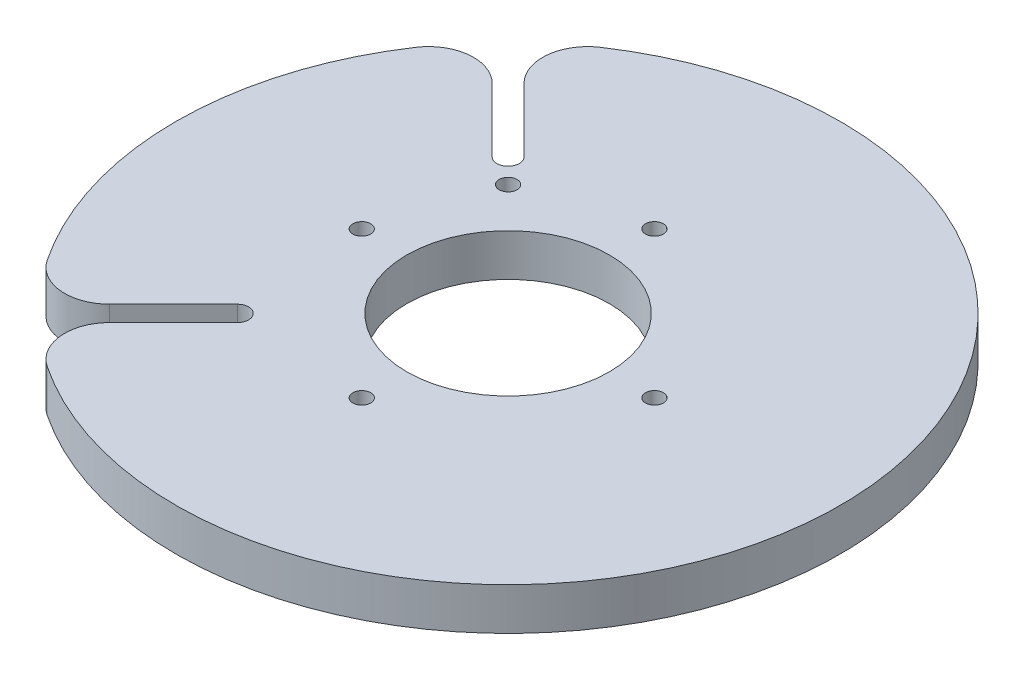
from build123d import *

# Parameters (mm, degrees)
SKETCH1_R           = 75
BOSS_EXTRUDE1_DEPTH = 9.525
CUT_EXTRUDE2_REACH  = 108.493
FILLET1_R           = 10.16
SKETCH39_R          = 22.86
SKETCH39_R_2        = 2.0193
CUT_EXTRUDE30_DEPTH = 247.31360274
SKETCH42_R          = 2.0193
CUT_EXTRUDE33_DEPTH = 247.31360274


with BuildPart() as part:
    # Sketch1 → Boss-Extrude1 (new body)
    with BuildSketch(Plane(origin=(0, 0, 0), x_dir=(1, 0, 0), z_dir=(0, 1, 0))):
        with Locations(Location((0, 0, 0), (0, 0, 90))):
            Circle(SKETCH1_R)
    extrude(amount=BOSS_EXTRUDE1_DEPTH)

    # Sketch11 → Cut-Extrude2 (cut, up to next)
    with BuildSketch(Plane(origin=(0, 9.525, 0), x_dir=(1, 0, 0), z_dir=(0, 1, 0)), mode=Mode.PRIVATE) as cut_extrude2_sk1:
        with BuildLine():
            Line((-54.798637954, 51.206535505), (-32.347997651, 28.755895202))
            ThreePointArc((-32.347997651, 28.755895202), (-28.755895202, 28.755895202), (-28.755895202, 32.347997651))
            Line((-28.755895202, 32.347997651), (-51.206535505, 54.798637954))
            ThreePointArc((-51.206535505, 54.798637954), (-53.033008589, 53.033008589), (-54.798637954, 51.206535505))
        make_face()
    cut_extrude2_tool1 = extrude(cut_extrude2_sk1.sketch, amount=-CUT_EXTRUDE2_REACH, mode=Mode.PRIVATE) & part.part
    # Sketch11 → Cut-Extrude2 (cut, up to next)
    with BuildSketch(Plane(origin=(0, 9.525, 0), x_dir=(1, 0, 0), z_dir=(0, 1, 0)), mode=Mode.PRIVATE) as cut_extrude2_sk2:
        with BuildLine():
            Line((-51.206535505, -54.798637954), (-28.755895202, -32.347997651))
            ThreePointArc((-28.755895202, -32.347997651), (-28.755895202, -28.755895202), (-32.347997651, -28.755895202))
            Line((-32.347997651, -28.755895202), (-54.798637954, -51.206535505))
            ThreePointArc((-54.798637954, -51.206535505), (-53.033008589, -53.033008589), (-51.206535505, -54.798637954))
        make_face()
    cut_extrude2_tool2 = extrude(cut_extrude2_sk2.sketch, amount=-CUT_EXTRUDE2_REACH, mode=Mode.PRIVATE) & part.part
    add(cut_extrude2_tool1.solids().sort_by_distance((-41.078737, 9.525, -41.078737))[0], mode=Mode.SUBTRACT)
    add(cut_extrude2_tool2.solids().sort_by_distance((-41.078737, 9.525, 41.078737))[0], mode=Mode.SUBTRACT)

    # Fillet1
    fillet1_edges = [part.edges().sort_by_distance(p)[0] for p in [
        (-51.206535505, 4.7625, 54.798637954),
        (-54.798637954, 4.7625, 51.206535505),
        (-54.798637954, 4.7625, -51.206535505),
        (-51.206535505, 4.7625, -54.798637954),
    ]]
    fillet(fillet1_edges, radius=FILLET1_R)

    # Sketch39 → Cut-Extrude30 (cut, through all)
    with BuildSketch(Plane(origin=(-73.768816189, 9.525, -121.080352405), x_dir=(1, 0, 0), z_dir=(0, 1, 0))):
        with Locations(Location((73.768816189, -121.080352405, 0), (0, 0, 270))):
            Circle(SKETCH39_R)
        with Locations(Location((73.768816189, -88.060352405, 0), (0, 0, 270))):
            Circle(SKETCH39_R_2)
        with Locations(Location((106.788816189, -121.080352405, 0), (0, 0, 270))):
            Circle(SKETCH39_R_2)
        with Locations(Location((73.768816189, -154.100352405, 0), (0, 0, 270))):
            Circle(SKETCH39_R_2)
        with Locations(Location((40.748816189, -121.080352405, 0), (0, 0, 270))):
            Circle(SKETCH39_R_2)
    extrude(amount=-CUT_EXTRUDE30_DEPTH, mode=Mode.SUBTRACT)

    # Sketch42 → Cut-Extrude33 (cut, through all)
    with BuildSketch(Plane(origin=(-73.768816189, 9.525, -121.080352405), x_dir=(1, 0, 0), z_dir=(0, 1, 0))):
        with Locations(Location((48.605023435, -95.916559651, 0), (0, 0, 270))):
            Circle(SKETCH42_R)
    extrude(amount=-CUT_EXTRUDE33_DEPTH, mode=Mode.SUBTRACT)


solid = part.part
